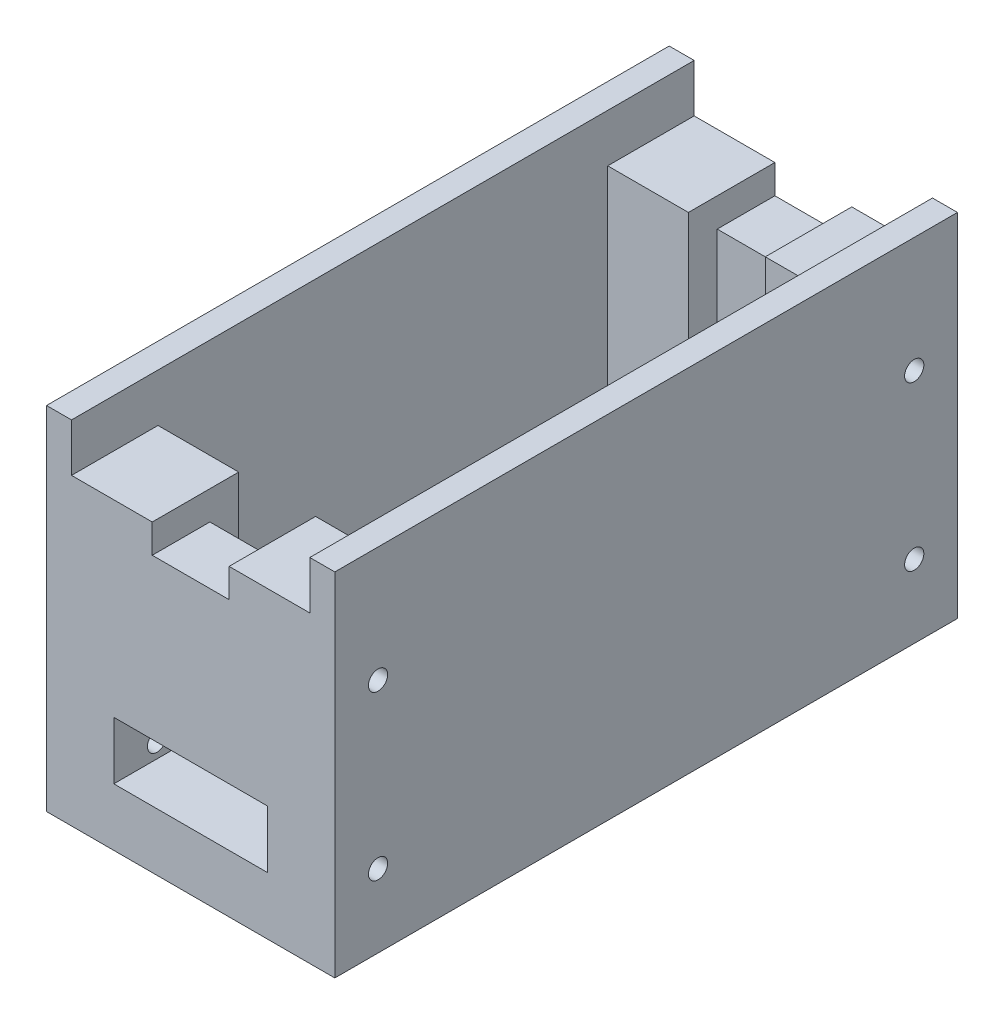
from build123d import *

# Parameters (mm, degrees)
SKETCH_1_W          = 15
SKETCH_1_H          = 32.4
SKETCH_1_R          = 0.8
EXTRUDE_1_DEPTH     = 2.2
SKETCH_2_W          = 15
SKETCH_2_H          = 32.4
SKETCH_2_W_2        = 12.4
SKETCH_2_H_2        = 23.4
EXTRUDE_2_DEPTH     = 15.8
EXTRUDE_START       = 15.8
SKETCH_2_3_W        = 1.3
SKETCH_2_3_H        = 4.5
SKETCH_2_3_H_2      = 23.4
EXTRUDE_3_DEPTH     = 2.5
SKETCH_3_W          = 8
SKETCH_3_H          = 3
SKETCH_3_W_2        = 4
SKETCH_3_H_2        = 1.5
CUT_EXTRUDE_1_DEPTH = 42.170499147
SKETCH_4_R          = 0.5
CUT_EXTRUDE_2_DEPTH = 42.170499147
SKETCH_5_W          = 32.4
SKETCH_5_H          = 2.2
CUT_EXTRUDE_3_DEPTH = 42.170499147
SKETCH_6_R          = 0.5
CUT_EXTRUDE_4_DEPTH = 2
SKETCH_7_W          = 4
SKETCH_7_H          = 1.5
CUT_EXTRUDE_5_DEPTH = 39.461019227


with BuildPart() as part:
    # 草图1 → 凸台-拉伸1 (new body)
    with BuildSketch(Plane(origin=(0, 0, 0), x_dir=(1, 0, 0), z_dir=(0, 1, 0))):
        with Locations((7.5, -16.2)):
            Rectangle(SKETCH_1_W, SKETCH_1_H)
        with Locations(Location((3, -3, 0), (0, 0, 270))):
            Circle(SKETCH_1_R, mode=Mode.SUBTRACT)
        with Locations(Location((12, -3, 0), (0, 0, 270))):
            Circle(SKETCH_1_R, mode=Mode.SUBTRACT)
        with Locations(Location((3, -29.4, 0), (0, 0, 270))):
            Circle(SKETCH_1_R, mode=Mode.SUBTRACT)
        with Locations(Location((12, -29.4, 0), (0, 0, 270))):
            Circle(SKETCH_1_R, mode=Mode.SUBTRACT)
    extrude(amount=EXTRUDE_1_DEPTH)

    # 草图2 → 凸台-拉伸2 (add)
    with BuildSketch(Plane(origin=(0, 2.2, 0), x_dir=(1, 0, 0), z_dir=(0, 1, 0))):
        with Locations((7.5, -16.2)):
            Rectangle(SKETCH_2_W, SKETCH_2_H)
        with Locations((7.5, -16.2)):
            Rectangle(SKETCH_2_W_2, SKETCH_2_H_2, mode=Mode.SUBTRACT)
    extrude(amount=EXTRUDE_2_DEPTH)

    # 草图2<3> → 凸台-拉伸3 (add)
    with BuildSketch(Plane(origin=(0, 2.2, 0), x_dir=(1, 0, 0), z_dir=(0, 1, 0)).offset(EXTRUDE_START)):
        with Locations((0.65, -2.25)):
            Rectangle(SKETCH_2_3_W, SKETCH_2_3_H)
        with Locations((0.65, -16.2)):
            Rectangle(SKETCH_2_3_W, SKETCH_2_3_H_2)
        with Locations((0.65, -30.15)):
            Rectangle(SKETCH_2_3_W, SKETCH_2_3_H)
        with Locations((14.35, -30.15)):
            Rectangle(SKETCH_2_3_W, SKETCH_2_3_H)
        with Locations((14.35, -16.2)):
            Rectangle(SKETCH_2_3_W, SKETCH_2_3_H_2)
        with Locations((14.35, -2.25)):
            Rectangle(SKETCH_2_3_W, SKETCH_2_3_H)
    extrude(amount=EXTRUDE_3_DEPTH)

    # 草图3 → 切除-拉伸1 (cut, through all)
    with BuildSketch(Plane(origin=(0, 0, 0), x_dir=(-1, 0, 0), z_dir=(0, 0, -1))):
        with Locations((-7.5, 6.7)):
            Rectangle(SKETCH_3_W, SKETCH_3_H)
        with Locations((-7.5, 17.25)):
            Rectangle(SKETCH_3_W_2, SKETCH_3_H_2)
    extrude(amount=-CUT_EXTRUDE_1_DEPTH, mode=Mode.SUBTRACT)

    # 草图4 → 切除-拉伸2 (cut, through all)
    with BuildSketch(Plane(origin=(15, 0, 0), x_dir=(0, 0, -1), z_dir=(1, 0, 0))):
        with Locations((-30.15, 6)):
            Circle(SKETCH_4_R)
        with Locations((-2.25, 6)):
            Circle(SKETCH_4_R)
        with Locations((-30.15, 14.5)):
            Circle(SKETCH_4_R)
        with Locations((-2.25, 14.5)):
            Circle(SKETCH_4_R)
    extrude(amount=-CUT_EXTRUDE_2_DEPTH, mode=Mode.SUBTRACT)

    # 草图5 → 切除-拉伸3 (cut, through all)
    with BuildSketch(Plane.ZY):
        with Locations((16.2, 1.1)):
            Rectangle(SKETCH_5_W, SKETCH_5_H)
    extrude(amount=-CUT_EXTRUDE_3_DEPTH, mode=Mode.SUBTRACT)

    # 草图6 → 切除-拉伸4 (cut)
    with BuildSketch(Plane.XZ.offset(-2.2)):
        with Locations(Location((12, 30.15, 0), (0, 0, 270))):
            Circle(SKETCH_6_R)
        with Locations(Location((3, 30.15, 0), (0, 0, 270))):
            Circle(SKETCH_6_R)
        with Locations(Location((12, 2.25, 0), (0, 0, 270))):
            Circle(SKETCH_6_R)
        with Locations(Location((3, 2.25, 0), (0, 0, 270))):
            Circle(SKETCH_6_R)
    extrude(amount=-CUT_EXTRUDE_4_DEPTH, mode=Mode.SUBTRACT)

    # 草图7 → 切除-拉伸5 (cut, through all)
    with BuildSketch(Plane(origin=(0, 16.5, 0), x_dir=(1, 0, 0), z_dir=(0, 1, 0))):
        with Locations((7.5, -28.65)):
            Rectangle(SKETCH_7_W, SKETCH_7_H)
        with Locations((7.5, -3.75)):
            Rectangle(SKETCH_7_W, SKETCH_7_H)
    extrude(amount=-CUT_EXTRUDE_5_DEPTH, mode=Mode.SUBTRACT)


solid = part.part
